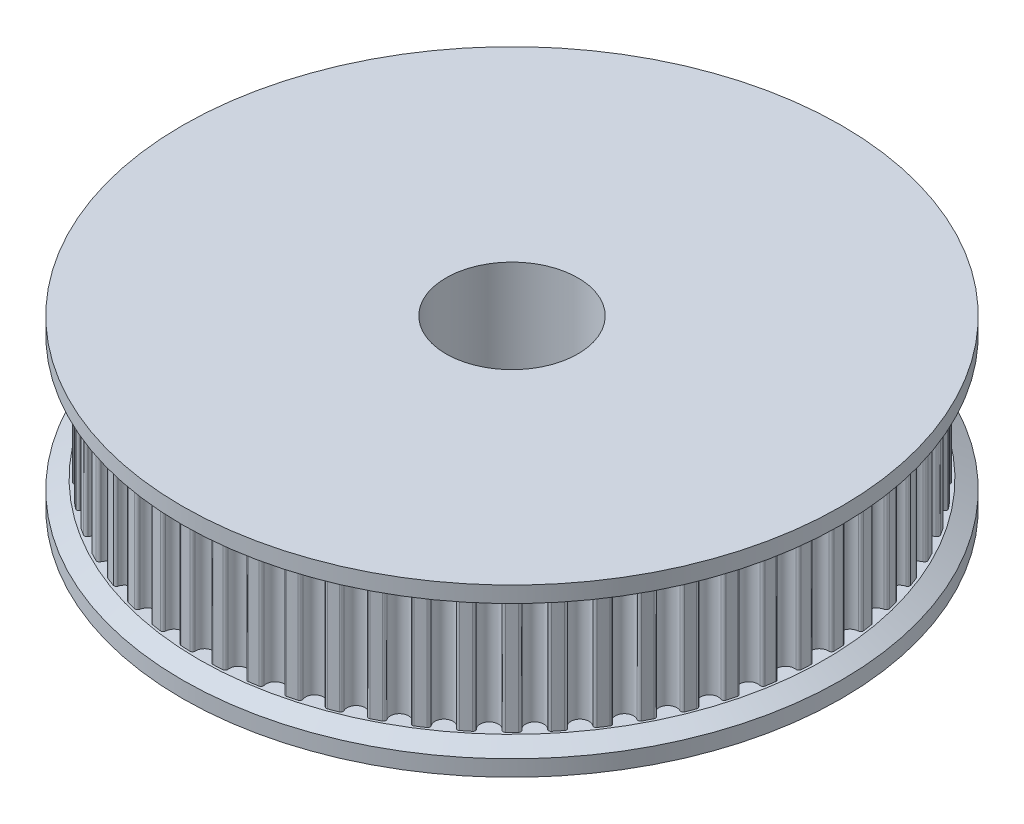
from build123d import *
from OCP.BRepFilletAPI import BRepFilletAPI_MakeChamfer

# Parameters (mm, degrees)
SKETCH_1_R               = 10
SKETCH_1_R_2             = 4
EXTRUDE_1_DEPTH          = 7.45
SKETCH_2_R               = 4
EXTRUDE_2_DEPTH          = 7
SKETCH_3_R               = 20
SKETCH_3_R_2             = 4
EXTRUDE_3_DEPTH          = 1.55
CUT_EXTRUDE_1_REACH      = 34.496
CUT_EXTRUDE_1_END_RADIUS = 10
SKETCH_4_R               = 1.5
CUT_EXTRUDE_2_REACH      = 34.496
CUT_EXTRUDE_2_END_RADIUS = 10
SKETCH_5_R               = 1.5
EXTRUDE_START            = 1.55
SKETCH_7_R               = 20
SKETCH_7_R_2             = 4
EXTRUDE_4_DEPTH          = 1.55
CHAMFER_1_SIZE           = 1
CHAMFER_1_SIZE2          = 0.577350269


with BuildPart() as part:
    # Эскиз1 → Бобышка-Вытянуть1 (new body)
    with BuildSketch(Plane(origin=(0, 0, 0), x_dir=(1, 0, 0), z_dir=(0, 1, 0))):
        with Locations(Location((0, 0, 0), (0, 0, 270))):
            Circle(SKETCH_1_R)
        with Locations(Location((0, 0, 0), (0, 0, 270))):
            Circle(SKETCH_1_R_2, mode=Mode.SUBTRACT)
    extrude(amount=EXTRUDE_1_DEPTH)

    # Эскиз2 → Бобышка-Вытянуть2 (add)
    with BuildSketch(Plane(origin=(0, 7.45, 0), x_dir=(1, 0, 0), z_dir=(0, 1, 0))):
        with BuildLine():
            ThreePointArc((1.268212169, 18.807289488), (0.986532775, 18.82416673), (0.704632299, 18.836825458))
            ThreePointArc((0.704632299, 18.836825458), (0.592145975, 18.792176877), (0.549234042, 18.67901666))
            ThreePointArc((0.549234042, 18.67901666), (0, 18.1), (-0.549234042, 18.67901666))
            ThreePointArc((-0.549234042, 18.67901666), (-0.592145975, 18.792176877), (-0.704632299, 18.836825458))
            ThreePointArc((-0.704632299, 18.836825458), (-0.986532775, 18.82416673), (-1.268212169, 18.807289488))
            ThreePointArc((-1.268212169, 18.807289488), (-1.375415233, 18.751127475), (-1.406263626, 18.634101643))
            ThreePointArc((-1.406263626, 18.634101643), (-1.891965185, 18.000846306), (-2.498714188, 18.519280462))
            ThreePointArc((-2.498714188, 18.519280462), (-2.553219508, 18.627335257), (-2.669756667, 18.659981226))
            ThreePointArc((-2.669756667, 18.659981226), (-2.948789666, 18.61792522), (-3.227161838, 18.571696919))
            ThreePointArc((-3.227161838, 18.571696919), (-3.327907104, 18.504636796), (-3.346353976, 18.385027509))
            ThreePointArc((-3.346353976, 18.385027509), (-3.763201604, 17.704471573), (-4.420817898, 18.156643152))
            ThreePointArc((-4.420817898, 18.156643152), (-4.486319434, 18.258408654), (-4.605630623, 18.278694334))
            ThreePointArc((-4.605630623, 18.278694334), (-4.878739, 18.207701826), (-5.150754047, 18.132628953))
            ThreePointArc((-5.150754047, 18.132628953), (-5.243937728, 18.055405444), (-5.249780971, 17.934523166))
            ThreePointArc((-5.249780971, 17.934523166), (-5.593207598, 17.214122945), (-6.294486201, 17.59507786))
            ThreePointArc((-6.294486201, 17.59507786), (-6.370266305, 17.689439105), (-6.491044326, 17.697142243))
            ThreePointArc((-6.491044326, 17.697142243), (-6.755235849, 17.597991039), (-7.017913517, 17.494896109))
            ThreePointArc((-7.017913517, 17.494896109), (-7.102514673, 17.408355292), (-7.095690268, 17.287524434))
            ThreePointArc((-7.095690268, 17.287524434), (-7.36193324, 16.535172783), (-8.099190797, 16.840737213))
            ThreePointArc((-8.099190797, 16.840737213), (-8.184419205, 16.926660359), (-8.305340789, 16.921696558))
            ThreePointArc((-8.305340789, 16.921696558), (-8.55772092, 16.795472981), (-8.808183258, 16.665485522))
            ThreePointArc((-8.808183258, 16.665485522), (-8.883274981, 16.570575556), (-8.863857697, 16.451119967))
            ThreePointArc((-8.863857697, 16.451119967), (-9.05, 15.675059808), (-9.815158964, 15.901885924))
            ThreePointArc((-9.815158964, 15.901885924), (-9.908901896, 15.97842958), (-10.0286422, 15.960853224))
            ThreePointArc((-10.0286422, 15.960853224), (-10.26644581, 15.808940206), (-10.5019487, 15.653484389))
            ThreePointArc((-10.5019487, 15.653484389), (-10.56670827, 15.551245126), (-10.534910846, 15.434473587))
            ThreePointArc((-10.534910846, 15.434473587), (-10.638913066, 14.643207598), (-11.423590195, 14.788810246))
            ThreePointArc((-11.423590195, 14.788810246), (-11.524820584, 14.855135783), (-11.642067708, 14.825139442))
            ThreePointArc((-11.642067708, 14.825139442), (-11.862689371, 14.649201373), (-12.080652594, 14.469980405))
            ThreePointArc((-12.080652594, 14.469980405), (-12.134370491, 14.361532001), (-12.090541307, 14.248723884))
            ThreePointArc((-12.090541307, 14.248723884), (-12.111263975, 13.450921341), (-12.906862181, 13.513705268))
            ThreePointArc((-12.906862181, 13.513705268), (-13.014470926, 13.56908601), (-13.127940287, 13.52699833))
            ThreePointArc((-13.127940287, 13.52699833), (-13.328962825, 13.328962825), (-13.52699833, 13.127940287))
            ThreePointArc((-13.52699833, 13.127940287), (-13.56908601, 13.014470926), (-13.513705268, 12.906862181))
            ThreePointArc((-13.513705268, 12.906862181), (-13.450921341, 12.111263975), (-14.248723884, 12.090541307))
            ThreePointArc((-14.248723884, 12.090541307), (-14.361532001, 12.134370491), (-14.469980405, 12.080652594))
            ThreePointArc((-14.469980405, 12.080652594), (-14.649201373, 11.862689371), (-14.825139442, 11.642067708))
            ThreePointArc((-14.825139442, 11.642067708), (-14.855135783, 11.524820584), (-14.788810246, 11.423590195))
            ThreePointArc((-14.788810246, 11.423590195), (-14.643207598, 10.638913066), (-15.434473587, 10.534910846))
            ThreePointArc((-15.434473587, 10.534910846), (-15.551245126, 10.56670827), (-15.653484389, 10.5019487))
            ThreePointArc((-15.653484389, 10.5019487), (-15.808940206, 10.26644581), (-15.960853224, 10.0286422))
            ThreePointArc((-15.960853224, 10.0286422), (-15.97842958, 9.908901896), (-15.901885924, 9.815158964))
            ThreePointArc((-15.901885924, 9.815158964), (-15.675059808, 9.05), (-16.451119967, 8.863857697))
            ThreePointArc((-16.451119967, 8.863857697), (-16.570575556, 8.883274981), (-16.665485522, 8.808183258))
            ThreePointArc((-16.665485522, 8.808183258), (-16.795472981, 8.55772092), (-16.921696558, 8.305340789))
            ThreePointArc((-16.921696558, 8.305340789), (-16.926660359, 8.184419205), (-16.840737213, 8.099190797))
            ThreePointArc((-16.840737213, 8.099190797), (-16.535172783, 7.36193324), (-17.287524434, 7.095690268))
            ThreePointArc((-17.287524434, 7.095690268), (-17.408355292, 7.102514673), (-17.494896109, 7.017913517))
            ThreePointArc((-17.494896109, 7.017913517), (-17.597991039, 6.755235849), (-17.697142243, 6.491044326))
            ThreePointArc((-17.697142243, 6.491044326), (-17.689439105, 6.370266305), (-17.59507786, 6.294486201))
            ThreePointArc((-17.59507786, 6.294486201), (-17.214122945, 5.593207598), (-17.934523166, 5.249780971))
            ThreePointArc((-17.934523166, 5.249780971), (-18.055405444, 5.243937728), (-18.132628953, 5.150754047))
            ThreePointArc((-18.132628953, 5.150754047), (-18.207701826, 4.878739), (-18.278694334, 4.605630623))
            ThreePointArc((-18.278694334, 4.605630623), (-18.258408654, 4.486319434), (-18.156643152, 4.420817898))
            ThreePointArc((-18.156643152, 4.420817898), (-17.704471573, 3.763201604), (-18.385027509, 3.346353976))
            ThreePointArc((-18.385027509, 3.346353976), (-18.504636796, 3.327907104), (-18.571696919, 3.227161838))
            ThreePointArc((-18.571696919, 3.227161838), (-18.61792522, 2.948789666), (-18.659981226, 2.669756667))
            ThreePointArc((-18.659981226, 2.669756667), (-18.627335257, 2.553219508), (-18.519280462, 2.498714188))
            ThreePointArc((-18.519280462, 2.498714188), (-18.000846306, 1.891965185), (-18.634101643, 1.406263626))
            ThreePointArc((-18.634101643, 1.406263626), (-18.751127475, 1.375415233), (-18.807289488, 1.268212169))
            ThreePointArc((-18.807289488, 1.268212169), (-18.82416673, 0.986532775), (-18.836825458, 0.704632299))
            ThreePointArc((-18.836825458, 0.704632299), (-18.792176877, 0.592145975), (-18.67901666, 0.549234042))
            ThreePointArc((-18.67901666, 0.549234042), (-18.1, 0), (-18.67901666, -0.549234042))
            ThreePointArc((-18.67901666, -0.549234042), (-18.792176877, -0.592145975), (-18.836825458, -0.704632299))
            ThreePointArc((-18.836825458, -0.704632299), (-18.82416673, -0.986532775), (-18.807289488, -1.268212169))
            ThreePointArc((-18.807289488, -1.268212169), (-18.751127475, -1.375415233), (-18.634101643, -1.406263626))
            ThreePointArc((-18.634101643, -1.406263626), (-18.000846306, -1.891965185), (-18.519280462, -2.498714188))
            ThreePointArc((-18.519280462, -2.498714188), (-18.627335257, -2.553219508), (-18.659981226, -2.669756667))
            ThreePointArc((-18.659981226, -2.669756667), (-18.61792522, -2.948789666), (-18.571696919, -3.227161838))
            ThreePointArc((-18.571696919, -3.227161838), (-18.504636796, -3.327907104), (-18.385027509, -3.346353976))
            ThreePointArc((-18.385027509, -3.346353976), (-17.704471573, -3.763201604), (-18.156643152, -4.420817898))
            ThreePointArc((-18.156643152, -4.420817898), (-18.258408654, -4.486319434), (-18.278694334, -4.605630623))
            ThreePointArc((-18.278694334, -4.605630623), (-18.207701826, -4.878739), (-18.132628953, -5.150754047))
            ThreePointArc((-18.132628953, -5.150754047), (-18.055405444, -5.243937728), (-17.934523166, -5.249780971))
            ThreePointArc((-17.934523166, -5.249780971), (-17.214122945, -5.593207598), (-17.59507786, -6.294486201))
            ThreePointArc((-17.59507786, -6.294486201), (-17.689439105, -6.370266305), (-17.697142243, -6.491044326))
            ThreePointArc((-17.697142243, -6.491044326), (-17.597991039, -6.755235849), (-17.494896109, -7.017913517))
            ThreePointArc((-17.494896109, -7.017913517), (-17.408355292, -7.102514673), (-17.287524434, -7.095690268))
            ThreePointArc((-17.287524434, -7.095690268), (-16.535172783, -7.36193324), (-16.840737213, -8.099190797))
            ThreePointArc((-16.840737213, -8.099190797), (-16.926660359, -8.184419205), (-16.921696558, -8.305340789))
            ThreePointArc((-16.921696558, -8.305340789), (-16.795472981, -8.55772092), (-16.665485522, -8.808183258))
            ThreePointArc((-16.665485522, -8.808183258), (-16.570575556, -8.883274981), (-16.451119967, -8.863857697))
            ThreePointArc((-16.451119967, -8.863857697), (-15.675059808, -9.05), (-15.901885924, -9.815158964))
            ThreePointArc((-15.901885924, -9.815158964), (-15.97842958, -9.908901896), (-15.960853224, -10.0286422))
            ThreePointArc((-15.960853224, -10.0286422), (-15.808940206, -10.26644581), (-15.653484389, -10.5019487))
            ThreePointArc((-15.653484389, -10.5019487), (-15.551245126, -10.56670827), (-15.434473587, -10.534910846))
            ThreePointArc((-15.434473587, -10.534910846), (-14.643207598, -10.638913066), (-14.788810246, -11.423590195))
            ThreePointArc((-14.788810246, -11.423590195), (-14.855135783, -11.524820584), (-14.825139442, -11.642067708))
            ThreePointArc((-14.825139442, -11.642067708), (-14.649201373, -11.862689371), (-14.469980405, -12.080652594))
            ThreePointArc((-14.469980405, -12.080652594), (-14.361532001, -12.134370491), (-14.248723884, -12.090541307))
            ThreePointArc((-14.248723884, -12.090541307), (-13.450921341, -12.111263975), (-13.513705268, -12.906862181))
            ThreePointArc((-13.513705268, -12.906862181), (-13.56908601, -13.014470926), (-13.52699833, -13.127940287))
            ThreePointArc((-13.52699833, -13.127940287), (-13.328962825, -13.328962825), (-13.127940287, -13.52699833))
            ThreePointArc((-13.127940287, -13.52699833), (-13.014470926, -13.56908601), (-12.906862181, -13.513705268))
            ThreePointArc((-12.906862181, -13.513705268), (-12.111263975, -13.450921341), (-12.090541307, -14.248723884))
            ThreePointArc((-12.090541307, -14.248723884), (-12.134370491, -14.361532001), (-12.080652594, -14.469980405))
            ThreePointArc((-12.080652594, -14.469980405), (-11.862689371, -14.649201373), (-11.642067708, -14.825139442))
            ThreePointArc((-11.642067708, -14.825139442), (-11.524820584, -14.855135783), (-11.423590195, -14.788810246))
            ThreePointArc((-11.423590195, -14.788810246), (-10.638913066, -14.643207598), (-10.534910846, -15.434473587))
            ThreePointArc((-10.534910846, -15.434473587), (-10.56670827, -15.551245126), (-10.5019487, -15.653484389))
            ThreePointArc((-10.5019487, -15.653484389), (-10.26644581, -15.808940206), (-10.0286422, -15.960853224))
            ThreePointArc((-10.0286422, -15.960853224), (-9.908901896, -15.97842958), (-9.815158964, -15.901885924))
            ThreePointArc((-9.815158964, -15.901885924), (-9.05, -15.675059808), (-8.863857697, -16.451119967))
            ThreePointArc((-8.863857697, -16.451119967), (-8.883274981, -16.570575556), (-8.808183258, -16.665485522))
            ThreePointArc((-8.808183258, -16.665485522), (-8.55772092, -16.795472981), (-8.305340789, -16.921696558))
            ThreePointArc((-8.305340789, -16.921696558), (-8.184419205, -16.926660359), (-8.099190797, -16.840737213))
            ThreePointArc((-8.099190797, -16.840737213), (-7.36193324, -16.535172783), (-7.095690268, -17.287524434))
            ThreePointArc((-7.095690268, -17.287524434), (-7.102514673, -17.408355292), (-7.017913517, -17.494896109))
            ThreePointArc((-7.017913517, -17.494896109), (-6.755235849, -17.597991039), (-6.491044326, -17.697142243))
            ThreePointArc((-6.491044326, -17.697142243), (-6.370266305, -17.689439105), (-6.294486201, -17.59507786))
            ThreePointArc((-6.294486201, -17.59507786), (-5.593207598, -17.214122945), (-5.249780971, -17.934523166))
            ThreePointArc((-5.249780971, -17.934523166), (-5.243937728, -18.055405444), (-5.150754047, -18.132628953))
            ThreePointArc((-5.150754047, -18.132628953), (-4.878739, -18.207701826), (-4.605630623, -18.278694334))
            ThreePointArc((-4.605630623, -18.278694334), (-4.486319434, -18.258408654), (-4.420817898, -18.156643152))
            ThreePointArc((-4.420817898, -18.156643152), (-3.763201604, -17.704471573), (-3.346353976, -18.385027509))
            ThreePointArc((-3.346353976, -18.385027509), (-3.327907104, -18.504636796), (-3.227161838, -18.571696919))
            ThreePointArc((-3.227161838, -18.571696919), (-2.948789666, -18.61792522), (-2.669756667, -18.659981226))
            ThreePointArc((-2.669756667, -18.659981226), (-2.553219508, -18.627335257), (-2.498714188, -18.519280462))
            ThreePointArc((-2.498714188, -18.519280462), (-1.891965185, -18.000846306), (-1.406263626, -18.634101643))
            ThreePointArc((-1.406263626, -18.634101643), (-1.375415233, -18.751127475), (-1.268212169, -18.807289488))
            ThreePointArc((-1.268212169, -18.807289488), (-0.986532775, -18.82416673), (-0.704632299, -18.836825458))
            ThreePointArc((-0.704632299, -18.836825458), (-0.592145975, -18.792176877), (-0.549234042, -18.67901666))
            ThreePointArc((-0.549234042, -18.67901666), (0, -18.1), (0.549234042, -18.67901666))
            ThreePointArc((0.549234042, -18.67901666), (0.592145975, -18.792176877), (0.704632299, -18.836825458))
            ThreePointArc((0.704632299, -18.836825458), (0.986532775, -18.82416673), (1.268212169, -18.807289488))
            ThreePointArc((1.268212169, -18.807289488), (1.375415233, -18.751127475), (1.406263626, -18.634101643))
            ThreePointArc((1.406263626, -18.634101643), (1.891965185, -18.000846306), (2.498714188, -18.519280462))
            ThreePointArc((2.498714188, -18.519280462), (2.553219508, -18.627335257), (2.669756667, -18.659981226))
            ThreePointArc((2.669756667, -18.659981226), (2.948789666, -18.61792522), (3.227161838, -18.571696919))
            ThreePointArc((3.227161838, -18.571696919), (3.327907104, -18.504636796), (3.346353976, -18.385027509))
            ThreePointArc((3.346353976, -18.385027509), (3.763201604, -17.704471573), (4.420817898, -18.156643152))
            ThreePointArc((4.420817898, -18.156643152), (4.486319434, -18.258408654), (4.605630623, -18.278694334))
            ThreePointArc((4.605630623, -18.278694334), (4.878739, -18.207701826), (5.150754047, -18.132628953))
            ThreePointArc((5.150754047, -18.132628953), (5.243937728, -18.055405444), (5.249780971, -17.934523166))
            ThreePointArc((5.249780971, -17.934523166), (5.593207598, -17.214122945), (6.294486201, -17.59507786))
            ThreePointArc((6.294486201, -17.59507786), (6.370266305, -17.689439105), (6.491044326, -17.697142243))
            ThreePointArc((6.491044326, -17.697142243), (6.755235849, -17.597991039), (7.017913517, -17.494896109))
            ThreePointArc((7.017913517, -17.494896109), (7.102514673, -17.408355292), (7.095690268, -17.287524434))
            ThreePointArc((7.095690268, -17.287524434), (7.36193324, -16.535172783), (8.099190797, -16.840737213))
            ThreePointArc((8.099190797, -16.840737213), (8.184419205, -16.926660359), (8.305340789, -16.921696558))
            ThreePointArc((8.305340789, -16.921696558), (8.55772092, -16.795472981), (8.808183258, -16.665485522))
            ThreePointArc((8.808183258, -16.665485522), (8.883274981, -16.570575556), (8.863857697, -16.451119967))
            ThreePointArc((8.863857697, -16.451119967), (9.05, -15.675059808), (9.815158964, -15.901885924))
            ThreePointArc((9.815158964, -15.901885924), (9.908901896, -15.97842958), (10.0286422, -15.960853224))
            ThreePointArc((10.0286422, -15.960853224), (10.26644581, -15.808940206), (10.5019487, -15.653484389))
            ThreePointArc((10.5019487, -15.653484389), (10.56670827, -15.551245126), (10.534910846, -15.434473587))
            ThreePointArc((10.534910846, -15.434473587), (10.638913066, -14.643207598), (11.423590195, -14.788810246))
            ThreePointArc((11.423590195, -14.788810246), (11.524820584, -14.855135783), (11.642067708, -14.825139442))
            ThreePointArc((11.642067708, -14.825139442), (11.862689371, -14.649201373), (12.080652594, -14.469980405))
            ThreePointArc((12.080652594, -14.469980405), (12.134370491, -14.361532001), (12.090541307, -14.248723884))
            ThreePointArc((12.090541307, -14.248723884), (12.111263975, -13.450921341), (12.906862181, -13.513705268))
            ThreePointArc((12.906862181, -13.513705268), (13.014470926, -13.56908601), (13.127940287, -13.52699833))
            ThreePointArc((13.127940287, -13.52699833), (13.328962825, -13.328962825), (13.52699833, -13.127940287))
            ThreePointArc((13.52699833, -13.127940287), (13.56908601, -13.014470926), (13.513705268, -12.906862181))
            ThreePointArc((13.513705268, -12.906862181), (13.450921341, -12.111263975), (14.248723884, -12.090541307))
            ThreePointArc((14.248723884, -12.090541307), (14.361532001, -12.134370491), (14.469980405, -12.080652594))
            ThreePointArc((14.469980405, -12.080652594), (14.649201373, -11.862689371), (14.825139442, -11.642067708))
            ThreePointArc((14.825139442, -11.642067708), (14.855135783, -11.524820584), (14.788810246, -11.423590195))
            ThreePointArc((14.788810246, -11.423590195), (14.643207598, -10.638913066), (15.434473587, -10.534910846))
            ThreePointArc((15.434473587, -10.534910846), (15.551245126, -10.56670827), (15.653484389, -10.5019487))
            ThreePointArc((15.653484389, -10.5019487), (15.808940206, -10.26644581), (15.960853224, -10.0286422))
            ThreePointArc((15.960853224, -10.0286422), (15.97842958, -9.908901896), (15.901885924, -9.815158964))
            ThreePointArc((15.901885924, -9.815158964), (15.675059808, -9.05), (16.451119967, -8.863857697))
            ThreePointArc((16.451119967, -8.863857697), (16.570575556, -8.883274981), (16.665485522, -8.808183258))
            ThreePointArc((16.665485522, -8.808183258), (16.795472981, -8.55772092), (16.921696558, -8.305340789))
            ThreePointArc((16.921696558, -8.305340789), (16.926660359, -8.184419205), (16.840737213, -8.099190797))
            ThreePointArc((16.840737213, -8.099190797), (16.535172783, -7.36193324), (17.287524434, -7.095690268))
            ThreePointArc((17.287524434, -7.095690268), (17.408355292, -7.102514673), (17.494896109, -7.017913517))
            ThreePointArc((17.494896109, -7.017913517), (17.597991039, -6.755235849), (17.697142243, -6.491044326))
            ThreePointArc((17.697142243, -6.491044326), (17.689439105, -6.370266305), (17.59507786, -6.294486201))
            ThreePointArc((17.59507786, -6.294486201), (17.214122945, -5.593207598), (17.934523166, -5.249780971))
            ThreePointArc((17.934523166, -5.249780971), (18.055405444, -5.243937728), (18.132628953, -5.150754047))
            ThreePointArc((18.132628953, -5.150754047), (18.207701826, -4.878739), (18.278694334, -4.605630623))
            ThreePointArc((18.278694334, -4.605630623), (18.258408654, -4.486319434), (18.156643152, -4.420817898))
            ThreePointArc((18.156643152, -4.420817898), (17.704471573, -3.763201604), (18.385027509, -3.346353976))
            ThreePointArc((18.385027509, -3.346353976), (18.504636796, -3.327907104), (18.571696919, -3.227161838))
            ThreePointArc((18.571696919, -3.227161838), (18.61792522, -2.948789666), (18.659981226, -2.669756667))
            ThreePointArc((18.659981226, -2.669756667), (18.627335257, -2.553219508), (18.519280462, -2.498714188))
            ThreePointArc((18.519280462, -2.498714188), (18.000846306, -1.891965185), (18.634101643, -1.406263626))
            ThreePointArc((18.634101643, -1.406263626), (18.751127475, -1.375415233), (18.807289488, -1.268212169))
            ThreePointArc((18.807289488, -1.268212169), (18.82416673, -0.986532775), (18.836825458, -0.704632299))
            ThreePointArc((18.836825458, -0.704632299), (18.792176877, -0.592145975), (18.67901666, -0.549234042))
            ThreePointArc((18.67901666, -0.549234042), (18.1, 0), (18.67901666, 0.549234042))
            ThreePointArc((18.67901666, 0.549234042), (18.792176877, 0.592145975), (18.836825458, 0.704632299))
            ThreePointArc((18.836825458, 0.704632299), (18.82416673, 0.986532775), (18.807289488, 1.268212169))
            ThreePointArc((18.807289488, 1.268212169), (18.751127475, 1.375415233), (18.634101643, 1.406263626))
            ThreePointArc((18.634101643, 1.406263626), (18.000846306, 1.891965185), (18.519280462, 2.498714188))
            ThreePointArc((18.519280462, 2.498714188), (18.627335257, 2.553219508), (18.659981226, 2.669756667))
            ThreePointArc((18.659981226, 2.669756667), (18.61792522, 2.948789666), (18.571696919, 3.227161838))
            ThreePointArc((18.571696919, 3.227161838), (18.504636796, 3.327907104), (18.385027509, 3.346353976))
            ThreePointArc((18.385027509, 3.346353976), (17.704471573, 3.763201604), (18.156643152, 4.420817898))
            ThreePointArc((18.156643152, 4.420817898), (18.258408654, 4.486319434), (18.278694334, 4.605630623))
            ThreePointArc((18.278694334, 4.605630623), (18.207701826, 4.878739), (18.132628953, 5.150754047))
            ThreePointArc((18.132628953, 5.150754047), (18.055405444, 5.243937728), (17.934523166, 5.249780971))
            ThreePointArc((17.934523166, 5.249780971), (17.214122945, 5.593207598), (17.59507786, 6.294486201))
            ThreePointArc((17.59507786, 6.294486201), (17.689439105, 6.370266305), (17.697142243, 6.491044326))
            ThreePointArc((17.697142243, 6.491044326), (17.597991039, 6.755235849), (17.494896109, 7.017913517))
            ThreePointArc((17.494896109, 7.017913517), (17.408355292, 7.102514673), (17.287524434, 7.095690268))
            ThreePointArc((17.287524434, 7.095690268), (16.535172783, 7.36193324), (16.840737213, 8.099190797))
            ThreePointArc((16.840737213, 8.099190797), (16.926660359, 8.184419205), (16.921696558, 8.305340789))
            ThreePointArc((16.921696558, 8.305340789), (16.795472981, 8.55772092), (16.665485522, 8.808183258))
            ThreePointArc((16.665485522, 8.808183258), (16.570575556, 8.883274981), (16.451119967, 8.863857697))
            ThreePointArc((16.451119967, 8.863857697), (15.675059808, 9.05), (15.901885924, 9.815158964))
            ThreePointArc((15.901885924, 9.815158964), (15.97842958, 9.908901896), (15.960853224, 10.0286422))
            ThreePointArc((15.960853224, 10.0286422), (15.808940206, 10.26644581), (15.653484389, 10.5019487))
            ThreePointArc((15.653484389, 10.5019487), (15.551245126, 10.56670827), (15.434473587, 10.534910846))
            ThreePointArc((15.434473587, 10.534910846), (14.643207598, 10.638913066), (14.788810246, 11.423590195))
            ThreePointArc((14.788810246, 11.423590195), (14.855135783, 11.524820584), (14.825139442, 11.642067708))
            ThreePointArc((14.825139442, 11.642067708), (14.649201373, 11.862689371), (14.469980405, 12.080652594))
            ThreePointArc((14.469980405, 12.080652594), (14.361532001, 12.134370491), (14.248723884, 12.090541307))
            ThreePointArc((14.248723884, 12.090541307), (13.450921341, 12.111263975), (13.513705268, 12.906862181))
            ThreePointArc((13.513705268, 12.906862181), (13.56908601, 13.014470926), (13.52699833, 13.127940287))
            ThreePointArc((13.52699833, 13.127940287), (13.328962825, 13.328962825), (13.127940287, 13.52699833))
            ThreePointArc((13.127940287, 13.52699833), (13.014470926, 13.56908601), (12.906862181, 13.513705268))
            ThreePointArc((12.906862181, 13.513705268), (12.111263975, 13.450921341), (12.090541307, 14.248723884))
            ThreePointArc((12.090541307, 14.248723884), (12.134370491, 14.361532001), (12.080652594, 14.469980405))
            ThreePointArc((12.080652594, 14.469980405), (11.862689371, 14.649201373), (11.642067708, 14.825139442))
            ThreePointArc((11.642067708, 14.825139442), (11.524820584, 14.855135783), (11.423590195, 14.788810246))
            ThreePointArc((11.423590195, 14.788810246), (10.638913066, 14.643207598), (10.534910846, 15.434473587))
            ThreePointArc((10.534910846, 15.434473587), (10.56670827, 15.551245126), (10.5019487, 15.653484389))
            ThreePointArc((10.5019487, 15.653484389), (10.26644581, 15.808940206), (10.0286422, 15.960853224))
            ThreePointArc((10.0286422, 15.960853224), (9.908901896, 15.97842958), (9.815158964, 15.901885924))
            ThreePointArc((9.815158964, 15.901885924), (9.05, 15.675059808), (8.863857697, 16.451119967))
            ThreePointArc((8.863857697, 16.451119967), (8.883274981, 16.570575556), (8.808183258, 16.665485522))
            ThreePointArc((8.808183258, 16.665485522), (8.55772092, 16.795472981), (8.305340789, 16.921696558))
            ThreePointArc((8.305340789, 16.921696558), (8.184419205, 16.926660359), (8.099190797, 16.840737213))
            ThreePointArc((8.099190797, 16.840737213), (7.36193324, 16.535172783), (7.095690268, 17.287524434))
            ThreePointArc((7.095690268, 17.287524434), (7.102514673, 17.408355292), (7.017913517, 17.494896109))
            ThreePointArc((7.017913517, 17.494896109), (6.755235849, 17.597991039), (6.491044326, 17.697142243))
            ThreePointArc((6.491044326, 17.697142243), (6.370266305, 17.689439105), (6.294486201, 17.59507786))
            ThreePointArc((6.294486201, 17.59507786), (5.593207598, 17.214122945), (5.249780971, 17.934523166))
            ThreePointArc((5.249780971, 17.934523166), (5.243937728, 18.055405444), (5.150754047, 18.132628953))
            ThreePointArc((5.150754047, 18.132628953), (4.878739, 18.207701826), (4.605630623, 18.278694334))
            ThreePointArc((4.605630623, 18.278694334), (4.486319434, 18.258408654), (4.420817898, 18.156643152))
            ThreePointArc((4.420817898, 18.156643152), (3.763201604, 17.704471573), (3.346353976, 18.385027509))
            ThreePointArc((3.346353976, 18.385027509), (3.327907104, 18.504636796), (3.227161838, 18.571696919))
            ThreePointArc((3.227161838, 18.571696919), (2.948789666, 18.61792522), (2.669756667, 18.659981226))
            ThreePointArc((2.669756667, 18.659981226), (2.553219508, 18.627335257), (2.498714188, 18.519280462))
            ThreePointArc((2.498714188, 18.519280462), (1.891965185, 18.000846306), (1.406263626, 18.634101643))
            ThreePointArc((1.406263626, 18.634101643), (1.375415233, 18.751127475), (1.268212169, 18.807289488))
        make_face()
        with Locations(Location((0, 0, 0), (0, 0, 270))):
            Circle(SKETCH_2_R, mode=Mode.SUBTRACT)
    extrude(amount=EXTRUDE_2_DEPTH)

    # Эскиз3 → Бобышка-Вытянуть3 (add)
    with BuildSketch(Plane(origin=(0, 14.45, 0), x_dir=(1, 0, 0), z_dir=(0, 1, 0))):
        with Locations(Location((0, 0, 0), (0, 0, 90))):
            Circle(SKETCH_3_R)
        with Locations(Location((0, 0, 0), (0, 0, 270))):
            Circle(SKETCH_3_R_2, mode=Mode.SUBTRACT)
    extrude(amount=EXTRUDE_3_DEPTH)

    # Вырез-Вытянуть1: up to this cylinder (the profile starts inside it)
    cut_extrude_1_end = Plane(origin=(0, 3.725, 0), z_dir=(0, -1, 0)) * Cylinder(CUT_EXTRUDE_1_END_RADIUS, 89.992, mode=Mode.PRIVATE)
    # Эскиз4 → Вырез-Вытянуть1 (cut, up to the surface)
    with BuildSketch(Plane.XY, mode=Mode.PRIVATE) as cut_extrude_1_sk1:
        with Locations(Location((0, 3.725, 0), (0, 0, 180))):
            Circle(SKETCH_4_R)
    cut_extrude_1_tool1 = extrude(cut_extrude_1_sk1.sketch, amount=CUT_EXTRUDE_1_REACH, mode=Mode.PRIVATE) & cut_extrude_1_end
    add(cut_extrude_1_tool1.solids().sort_by_distance((0, 3.725, 0))[0], mode=Mode.SUBTRACT)

    # Вырез-Вытянуть2: up to this cylinder (the profile starts inside it)
    cut_extrude_2_end = Plane(origin=(0, 3.725, 0), z_dir=(0, -1, 0)) * Cylinder(CUT_EXTRUDE_2_END_RADIUS, 89.992, mode=Mode.PRIVATE)
    # Эскиз5 → Вырез-Вытянуть2 (cut, up to the surface)
    with BuildSketch(Plane(origin=(0, 0, 0), x_dir=(0, 0, -1), z_dir=(1, 0, 0)), mode=Mode.PRIVATE) as cut_extrude_2_sk1:
        with Locations(Location((0, 3.725, 0), (0, 0, 180))):
            Circle(SKETCH_5_R)
    cut_extrude_2_tool1 = extrude(cut_extrude_2_sk1.sketch, amount=CUT_EXTRUDE_2_REACH, mode=Mode.PRIVATE) & cut_extrude_2_end
    add(cut_extrude_2_tool1.solids().sort_by_distance((0, 3.725, 0))[0], mode=Mode.SUBTRACT)

    # Эскиз7 → Бобышка-Вытянуть4 (add)
    with BuildSketch(Plane.XZ.offset(-7.45).offset(EXTRUDE_START)):
        with Locations(Location((0, 0, 0), (0, 0, 270))):
            Circle(SKETCH_7_R)
        with Locations(Location((0, 0, 0), (0, 0, 90))):
            Circle(SKETCH_7_R_2, mode=Mode.SUBTRACT)
    extrude(amount=-EXTRUDE_4_DEPTH)

    # Фаска1: one chamfer whose edges measure the first distance from different faces: ONE call of the kernel's chamfer builder (chamfer() names one face for all edges)
    chamfer_1_edges_1 = [part.edges().sort_by_distance(p)[0] for p in [
        (0, 14.45, 20),
    ]]
    chamfer_1_side_1 = [part.faces().sort_by_distance(p)[0] for p in [
        (0, 14.45, 19.434314575),
    ]]
    chamfer_1_edges_2 = [part.edges().sort_by_distance(p)[0] for p in [
        (0, 7.45, 20),
    ]]
    chamfer_1_side_2 = [part.faces().sort_by_distance(p)[0] for p in [
        (0, 7.45, 19.434314575),
    ]]
    chamfer_1 = BRepFilletAPI_MakeChamfer(part.part.solid().wrapped)
    for e in chamfer_1_edges_1:
        chamfer_1.Add(CHAMFER_1_SIZE, CHAMFER_1_SIZE2, e.wrapped, chamfer_1_side_1[0].wrapped)  # the first distance lies on this face
    for e in chamfer_1_edges_2:
        chamfer_1.Add(CHAMFER_1_SIZE, CHAMFER_1_SIZE2, e.wrapped, chamfer_1_side_2[0].wrapped)  # the first distance lies on this face
    add(Compound.cast(chamfer_1.Shape()), mode=Mode.REPLACE)


solid = part.part
